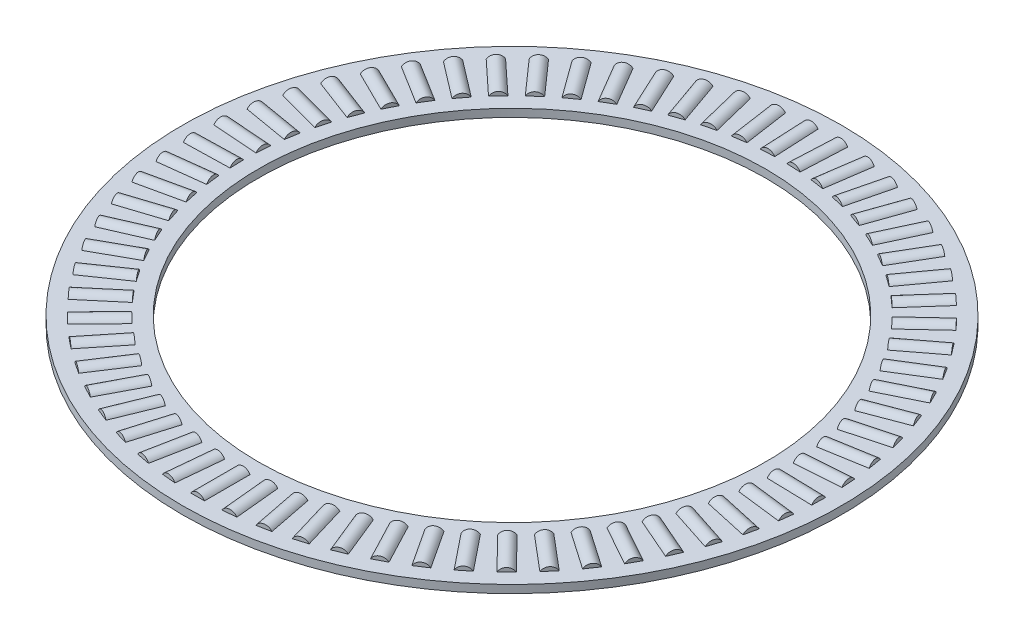
from build123d import *

# Parameters (mm, degrees)
SKETCH5_W         = 9.4996
SKETCH5_H         = 0.9921875
SKETCH3_W         = 5.69976
SKETCH3_H         = 0.9921875
SKETCH2_W         = 5.69976
SKETCH2_H         = 0.9921875
CIRPATTERN1_COUNT = 65
CIRPATTERN1_ANGLE = 354.461538462
CIRPATTERN2_COUNT = 65


with BuildPart() as part:
    # Sketch5 → Revolve3 (revolve)
    with BuildSketch(Plane(origin=(0, 0, 0), x_dir=(0, 0, -1), z_dir=(1, 0, 0)), mode=Mode.PRIVATE) as revolve3_sk:
        with Locations((-36.5252, 0)):
            Rectangle(SKETCH5_W, SKETCH5_H)
    revolve(revolve3_sk.sketch.rotate(Axis((0, -0.9921875, 0), (0, 1, 0)), 180), axis=Axis((0, -0.9921875, 0), (0, 1, 0)))

    # Sketch3 → Cut-Revolve1 (revolve, cut)
    with BuildSketch(Plane(origin=(0, 0, 0), x_dir=(0, 0, -1), z_dir=(1, 0, 0))):
        with Locations((-36.5252, 0.49609375)):
            Rectangle(SKETCH3_W, SKETCH3_H)
    cut_revolve1 = revolve(axis=Axis((0, 0, 39.37508), (0, 0, -1)), mode=Mode.SUBTRACT)

    # CirPattern2: Cut-Revolve1 ×65 about axis
    cirpattern2_axis = Axis((0, 0, 0), (0, 1, 0))
    for i in range(1, CIRPATTERN2_COUNT):
        add(cut_revolve1.rotate(cirpattern2_axis, i * 360 / CIRPATTERN2_COUNT), mode=Mode.SUBTRACT)


with BuildPart() as body_2:
    # Sketch2 → Revolve2 (revolve)
    with BuildSketch(Plane(origin=(0, 0, 0), x_dir=(0, 0, -1), z_dir=(1, 0, 0)), mode=Mode.PRIVATE) as revolve2_sk:
        with Locations((-36.5252, 0.49609375)):
            Rectangle(SKETCH2_W, SKETCH2_H)
    revolve(revolve2_sk.sketch.rotate(Axis((0, 0, 39.37508), (0, 0, -1)), 90), axis=Axis((0, 0, 39.37508), (0, 0, -1)))


with BuildPart() as cirpattern1_1:
    # CirPattern1: pattern copy
    add(body_2.part.rotate(Axis((0, 0.9921875, 0), (0, -1, 0)), 1 * CIRPATTERN1_ANGLE / (CIRPATTERN1_COUNT - 1)))


with BuildPart() as cirpattern1_2:
    # CirPattern1: pattern copy
    add(body_2.part.rotate(Axis((0, 0.9921875, 0), (0, -1, 0)), 2 * CIRPATTERN1_ANGLE / (CIRPATTERN1_COUNT - 1)))


with BuildPart() as cirpattern1_3:
    # CirPattern1: pattern copy
    add(body_2.part.rotate(Axis((0, 0.9921875, 0), (0, -1, 0)), 3 * CIRPATTERN1_ANGLE / (CIRPATTERN1_COUNT - 1)))


with BuildPart() as cirpattern1_4:
    # CirPattern1: pattern copy
    add(body_2.part.rotate(Axis((0, 0.9921875, 0), (0, -1, 0)), 4 * CIRPATTERN1_ANGLE / (CIRPATTERN1_COUNT - 1)))


with BuildPart() as cirpattern1_5:
    # CirPattern1: pattern copy
    add(body_2.part.rotate(Axis((0, 0.9921875, 0), (0, -1, 0)), 5 * CIRPATTERN1_ANGLE / (CIRPATTERN1_COUNT - 1)))


with BuildPart() as cirpattern1_6:
    # CirPattern1: pattern copy
    add(body_2.part.rotate(Axis((0, 0.9921875, 0), (0, -1, 0)), 6 * CIRPATTERN1_ANGLE / (CIRPATTERN1_COUNT - 1)))


with BuildPart() as cirpattern1_7:
    # CirPattern1: pattern copy
    add(body_2.part.rotate(Axis((0, 0.9921875, 0), (0, -1, 0)), 7 * CIRPATTERN1_ANGLE / (CIRPATTERN1_COUNT - 1)))


with BuildPart() as cirpattern1_8:
    # CirPattern1: pattern copy
    add(body_2.part.rotate(Axis((0, 0.9921875, 0), (0, -1, 0)), 8 * CIRPATTERN1_ANGLE / (CIRPATTERN1_COUNT - 1)))


with BuildPart() as cirpattern1_9:
    # CirPattern1: pattern copy
    add(body_2.part.rotate(Axis((0, 0.9921875, 0), (0, -1, 0)), 9 * CIRPATTERN1_ANGLE / (CIRPATTERN1_COUNT - 1)))


with BuildPart() as cirpattern1_10:
    # CirPattern1: pattern copy
    add(body_2.part.rotate(Axis((0, 0.9921875, 0), (0, -1, 0)), 10 * CIRPATTERN1_ANGLE / (CIRPATTERN1_COUNT - 1)))


with BuildPart() as cirpattern1_11:
    # CirPattern1: pattern copy
    add(body_2.part.rotate(Axis((0, 0.9921875, 0), (0, -1, 0)), 11 * CIRPATTERN1_ANGLE / (CIRPATTERN1_COUNT - 1)))


with BuildPart() as cirpattern1_12:
    # CirPattern1: pattern copy
    add(body_2.part.rotate(Axis((0, 0.9921875, 0), (0, -1, 0)), 12 * CIRPATTERN1_ANGLE / (CIRPATTERN1_COUNT - 1)))


with BuildPart() as cirpattern1_13:
    # CirPattern1: pattern copy
    add(body_2.part.rotate(Axis((0, 0.9921875, 0), (0, -1, 0)), 13 * CIRPATTERN1_ANGLE / (CIRPATTERN1_COUNT - 1)))


with BuildPart() as cirpattern1_14:
    # CirPattern1: pattern copy
    add(body_2.part.rotate(Axis((0, 0.9921875, 0), (0, -1, 0)), 14 * CIRPATTERN1_ANGLE / (CIRPATTERN1_COUNT - 1)))


with BuildPart() as cirpattern1_15:
    # CirPattern1: pattern copy
    add(body_2.part.rotate(Axis((0, 0.9921875, 0), (0, -1, 0)), 15 * CIRPATTERN1_ANGLE / (CIRPATTERN1_COUNT - 1)))


with BuildPart() as cirpattern1_16:
    # CirPattern1: pattern copy
    add(body_2.part.rotate(Axis((0, 0.9921875, 0), (0, -1, 0)), 16 * CIRPATTERN1_ANGLE / (CIRPATTERN1_COUNT - 1)))


with BuildPart() as cirpattern1_17:
    # CirPattern1: pattern copy
    add(body_2.part.rotate(Axis((0, 0.9921875, 0), (0, -1, 0)), 17 * CIRPATTERN1_ANGLE / (CIRPATTERN1_COUNT - 1)))


with BuildPart() as cirpattern1_18:
    # CirPattern1: pattern copy
    add(body_2.part.rotate(Axis((0, 0.9921875, 0), (0, -1, 0)), 18 * CIRPATTERN1_ANGLE / (CIRPATTERN1_COUNT - 1)))


with BuildPart() as cirpattern1_19:
    # CirPattern1: pattern copy
    add(body_2.part.rotate(Axis((0, 0.9921875, 0), (0, -1, 0)), 19 * CIRPATTERN1_ANGLE / (CIRPATTERN1_COUNT - 1)))


with BuildPart() as cirpattern1_20:
    # CirPattern1: pattern copy
    add(body_2.part.rotate(Axis((0, 0.9921875, 0), (0, -1, 0)), 20 * CIRPATTERN1_ANGLE / (CIRPATTERN1_COUNT - 1)))


with BuildPart() as cirpattern1_21:
    # CirPattern1: pattern copy
    add(body_2.part.rotate(Axis((0, 0.9921875, 0), (0, -1, 0)), 21 * CIRPATTERN1_ANGLE / (CIRPATTERN1_COUNT - 1)))


with BuildPart() as cirpattern1_22:
    # CirPattern1: pattern copy
    add(body_2.part.rotate(Axis((0, 0.9921875, 0), (0, -1, 0)), 22 * CIRPATTERN1_ANGLE / (CIRPATTERN1_COUNT - 1)))


with BuildPart() as cirpattern1_23:
    # CirPattern1: pattern copy
    add(body_2.part.rotate(Axis((0, 0.9921875, 0), (0, -1, 0)), 23 * CIRPATTERN1_ANGLE / (CIRPATTERN1_COUNT - 1)))


with BuildPart() as cirpattern1_24:
    # CirPattern1: pattern copy
    add(body_2.part.rotate(Axis((0, 0.9921875, 0), (0, -1, 0)), 24 * CIRPATTERN1_ANGLE / (CIRPATTERN1_COUNT - 1)))


with BuildPart() as cirpattern1_25:
    # CirPattern1: pattern copy
    add(body_2.part.rotate(Axis((0, 0.9921875, 0), (0, -1, 0)), 25 * CIRPATTERN1_ANGLE / (CIRPATTERN1_COUNT - 1)))


with BuildPart() as cirpattern1_26:
    # CirPattern1: pattern copy
    add(body_2.part.rotate(Axis((0, 0.9921875, 0), (0, -1, 0)), 26 * CIRPATTERN1_ANGLE / (CIRPATTERN1_COUNT - 1)))


with BuildPart() as cirpattern1_27:
    # CirPattern1: pattern copy
    add(body_2.part.rotate(Axis((0, 0.9921875, 0), (0, -1, 0)), 27 * CIRPATTERN1_ANGLE / (CIRPATTERN1_COUNT - 1)))


with BuildPart() as cirpattern1_28:
    # CirPattern1: pattern copy
    add(body_2.part.rotate(Axis((0, 0.9921875, 0), (0, -1, 0)), 28 * CIRPATTERN1_ANGLE / (CIRPATTERN1_COUNT - 1)))


with BuildPart() as cirpattern1_29:
    # CirPattern1: pattern copy
    add(body_2.part.rotate(Axis((0, 0.9921875, 0), (0, -1, 0)), 29 * CIRPATTERN1_ANGLE / (CIRPATTERN1_COUNT - 1)))


with BuildPart() as cirpattern1_30:
    # CirPattern1: pattern copy
    add(body_2.part.rotate(Axis((0, 0.9921875, 0), (0, -1, 0)), 30 * CIRPATTERN1_ANGLE / (CIRPATTERN1_COUNT - 1)))


with BuildPart() as cirpattern1_31:
    # CirPattern1: pattern copy
    add(body_2.part.rotate(Axis((0, 0.9921875, 0), (0, -1, 0)), 31 * CIRPATTERN1_ANGLE / (CIRPATTERN1_COUNT - 1)))


with BuildPart() as cirpattern1_32:
    # CirPattern1: pattern copy
    add(body_2.part.rotate(Axis((0, 0.9921875, 0), (0, -1, 0)), 32 * CIRPATTERN1_ANGLE / (CIRPATTERN1_COUNT - 1)))


with BuildPart() as cirpattern1_33:
    # CirPattern1: pattern copy
    add(body_2.part.rotate(Axis((0, 0.9921875, 0), (0, -1, 0)), 33 * CIRPATTERN1_ANGLE / (CIRPATTERN1_COUNT - 1)))


with BuildPart() as cirpattern1_34:
    # CirPattern1: pattern copy
    add(body_2.part.rotate(Axis((0, 0.9921875, 0), (0, -1, 0)), 34 * CIRPATTERN1_ANGLE / (CIRPATTERN1_COUNT - 1)))


with BuildPart() as cirpattern1_35:
    # CirPattern1: pattern copy
    add(body_2.part.rotate(Axis((0, 0.9921875, 0), (0, -1, 0)), 35 * CIRPATTERN1_ANGLE / (CIRPATTERN1_COUNT - 1)))


with BuildPart() as cirpattern1_36:
    # CirPattern1: pattern copy
    add(body_2.part.rotate(Axis((0, 0.9921875, 0), (0, -1, 0)), 36 * CIRPATTERN1_ANGLE / (CIRPATTERN1_COUNT - 1)))


with BuildPart() as cirpattern1_37:
    # CirPattern1: pattern copy
    add(body_2.part.rotate(Axis((0, 0.9921875, 0), (0, -1, 0)), 37 * CIRPATTERN1_ANGLE / (CIRPATTERN1_COUNT - 1)))


with BuildPart() as cirpattern1_38:
    # CirPattern1: pattern copy
    add(body_2.part.rotate(Axis((0, 0.9921875, 0), (0, -1, 0)), 38 * CIRPATTERN1_ANGLE / (CIRPATTERN1_COUNT - 1)))


with BuildPart() as cirpattern1_39:
    # CirPattern1: pattern copy
    add(body_2.part.rotate(Axis((0, 0.9921875, 0), (0, -1, 0)), 39 * CIRPATTERN1_ANGLE / (CIRPATTERN1_COUNT - 1)))


with BuildPart() as cirpattern1_40:
    # CirPattern1: pattern copy
    add(body_2.part.rotate(Axis((0, 0.9921875, 0), (0, -1, 0)), 40 * CIRPATTERN1_ANGLE / (CIRPATTERN1_COUNT - 1)))


with BuildPart() as cirpattern1_41:
    # CirPattern1: pattern copy
    add(body_2.part.rotate(Axis((0, 0.9921875, 0), (0, -1, 0)), 41 * CIRPATTERN1_ANGLE / (CIRPATTERN1_COUNT - 1)))


with BuildPart() as cirpattern1_42:
    # CirPattern1: pattern copy
    add(body_2.part.rotate(Axis((0, 0.9921875, 0), (0, -1, 0)), 42 * CIRPATTERN1_ANGLE / (CIRPATTERN1_COUNT - 1)))


with BuildPart() as cirpattern1_43:
    # CirPattern1: pattern copy
    add(body_2.part.rotate(Axis((0, 0.9921875, 0), (0, -1, 0)), 43 * CIRPATTERN1_ANGLE / (CIRPATTERN1_COUNT - 1)))


with BuildPart() as cirpattern1_44:
    # CirPattern1: pattern copy
    add(body_2.part.rotate(Axis((0, 0.9921875, 0), (0, -1, 0)), 44 * CIRPATTERN1_ANGLE / (CIRPATTERN1_COUNT - 1)))


with BuildPart() as cirpattern1_45:
    # CirPattern1: pattern copy
    add(body_2.part.rotate(Axis((0, 0.9921875, 0), (0, -1, 0)), 45 * CIRPATTERN1_ANGLE / (CIRPATTERN1_COUNT - 1)))


with BuildPart() as cirpattern1_46:
    # CirPattern1: pattern copy
    add(body_2.part.rotate(Axis((0, 0.9921875, 0), (0, -1, 0)), 46 * CIRPATTERN1_ANGLE / (CIRPATTERN1_COUNT - 1)))


with BuildPart() as cirpattern1_47:
    # CirPattern1: pattern copy
    add(body_2.part.rotate(Axis((0, 0.9921875, 0), (0, -1, 0)), 47 * CIRPATTERN1_ANGLE / (CIRPATTERN1_COUNT - 1)))


with BuildPart() as cirpattern1_48:
    # CirPattern1: pattern copy
    add(body_2.part.rotate(Axis((0, 0.9921875, 0), (0, -1, 0)), 48 * CIRPATTERN1_ANGLE / (CIRPATTERN1_COUNT - 1)))


with BuildPart() as cirpattern1_49:
    # CirPattern1: pattern copy
    add(body_2.part.rotate(Axis((0, 0.9921875, 0), (0, -1, 0)), 49 * CIRPATTERN1_ANGLE / (CIRPATTERN1_COUNT - 1)))


with BuildPart() as cirpattern1_50:
    # CirPattern1: pattern copy
    add(body_2.part.rotate(Axis((0, 0.9921875, 0), (0, -1, 0)), 50 * CIRPATTERN1_ANGLE / (CIRPATTERN1_COUNT - 1)))


with BuildPart() as cirpattern1_51:
    # CirPattern1: pattern copy
    add(body_2.part.rotate(Axis((0, 0.9921875, 0), (0, -1, 0)), 51 * CIRPATTERN1_ANGLE / (CIRPATTERN1_COUNT - 1)))


with BuildPart() as cirpattern1_52:
    # CirPattern1: pattern copy
    add(body_2.part.rotate(Axis((0, 0.9921875, 0), (0, -1, 0)), 52 * CIRPATTERN1_ANGLE / (CIRPATTERN1_COUNT - 1)))


with BuildPart() as cirpattern1_53:
    # CirPattern1: pattern copy
    add(body_2.part.rotate(Axis((0, 0.9921875, 0), (0, -1, 0)), 53 * CIRPATTERN1_ANGLE / (CIRPATTERN1_COUNT - 1)))


with BuildPart() as cirpattern1_54:
    # CirPattern1: pattern copy
    add(body_2.part.rotate(Axis((0, 0.9921875, 0), (0, -1, 0)), 54 * CIRPATTERN1_ANGLE / (CIRPATTERN1_COUNT - 1)))


with BuildPart() as cirpattern1_55:
    # CirPattern1: pattern copy
    add(body_2.part.rotate(Axis((0, 0.9921875, 0), (0, -1, 0)), 55 * CIRPATTERN1_ANGLE / (CIRPATTERN1_COUNT - 1)))


with BuildPart() as cirpattern1_56:
    # CirPattern1: pattern copy
    add(body_2.part.rotate(Axis((0, 0.9921875, 0), (0, -1, 0)), 56 * CIRPATTERN1_ANGLE / (CIRPATTERN1_COUNT - 1)))


with BuildPart() as cirpattern1_57:
    # CirPattern1: pattern copy
    add(body_2.part.rotate(Axis((0, 0.9921875, 0), (0, -1, 0)), 57 * CIRPATTERN1_ANGLE / (CIRPATTERN1_COUNT - 1)))


with BuildPart() as cirpattern1_58:
    # CirPattern1: pattern copy
    add(body_2.part.rotate(Axis((0, 0.9921875, 0), (0, -1, 0)), 58 * CIRPATTERN1_ANGLE / (CIRPATTERN1_COUNT - 1)))


with BuildPart() as cirpattern1_59:
    # CirPattern1: pattern copy
    add(body_2.part.rotate(Axis((0, 0.9921875, 0), (0, -1, 0)), 59 * CIRPATTERN1_ANGLE / (CIRPATTERN1_COUNT - 1)))


with BuildPart() as cirpattern1_60:
    # CirPattern1: pattern copy
    add(body_2.part.rotate(Axis((0, 0.9921875, 0), (0, -1, 0)), 60 * CIRPATTERN1_ANGLE / (CIRPATTERN1_COUNT - 1)))


with BuildPart() as cirpattern1_61:
    # CirPattern1: pattern copy
    add(body_2.part.rotate(Axis((0, 0.9921875, 0), (0, -1, 0)), 61 * CIRPATTERN1_ANGLE / (CIRPATTERN1_COUNT - 1)))


with BuildPart() as cirpattern1_62:
    # CirPattern1: pattern copy
    add(body_2.part.rotate(Axis((0, 0.9921875, 0), (0, -1, 0)), 62 * CIRPATTERN1_ANGLE / (CIRPATTERN1_COUNT - 1)))


with BuildPart() as cirpattern1_63:
    # CirPattern1: pattern copy
    add(body_2.part.rotate(Axis((0, 0.9921875, 0), (0, -1, 0)), 63 * CIRPATTERN1_ANGLE / (CIRPATTERN1_COUNT - 1)))


with BuildPart() as cirpattern1_64:
    # CirPattern1: pattern copy
    add(body_2.part.rotate(Axis((0, 0.9921875, 0), (0, -1, 0)), 64 * CIRPATTERN1_ANGLE / (CIRPATTERN1_COUNT - 1)))


solid = Compound([part.part, body_2.part, cirpattern1_1.part, cirpattern1_2.part, cirpattern1_3.part, cirpattern1_4.part, cirpattern1_5.part, cirpattern1_6.part, cirpattern1_7.part, cirpattern1_8.part, cirpattern1_9.part, cirpattern1_10.part, cirpattern1_11.part, cirpattern1_12.part, cirpattern1_13.part, cirpattern1_14.part, cirpattern1_15.part, cirpattern1_16.part, cirpattern1_17.part, cirpattern1_18.part, cirpattern1_19.part, cirpattern1_20.part, cirpattern1_21.part, cirpattern1_22.part, cirpattern1_23.part, cirpattern1_24.part, cirpattern1_25.part, cirpattern1_26.part, cirpattern1_27.part, cirpattern1_28.part, cirpattern1_29.part, cirpattern1_30.part, cirpattern1_31.part, cirpattern1_32.part, cirpattern1_33.part, cirpattern1_34.part, cirpattern1_35.part, cirpattern1_36.part, cirpattern1_37.part, cirpattern1_38.part, cirpattern1_39.part, cirpattern1_40.part, cirpattern1_41.part, cirpattern1_42.part, cirpattern1_43.part, cirpattern1_44.part, cirpattern1_45.part, cirpattern1_46.part, cirpattern1_47.part, cirpattern1_48.part, cirpattern1_49.part, cirpattern1_50.part, cirpattern1_51.part, cirpattern1_52.part, cirpattern1_53.part, cirpattern1_54.part, cirpattern1_55.part, cirpattern1_56.part, cirpattern1_57.part, cirpattern1_58.part, cirpattern1_59.part, cirpattern1_60.part, cirpattern1_61.part, cirpattern1_62.part, cirpattern1_63.part, cirpattern1_64.part])
